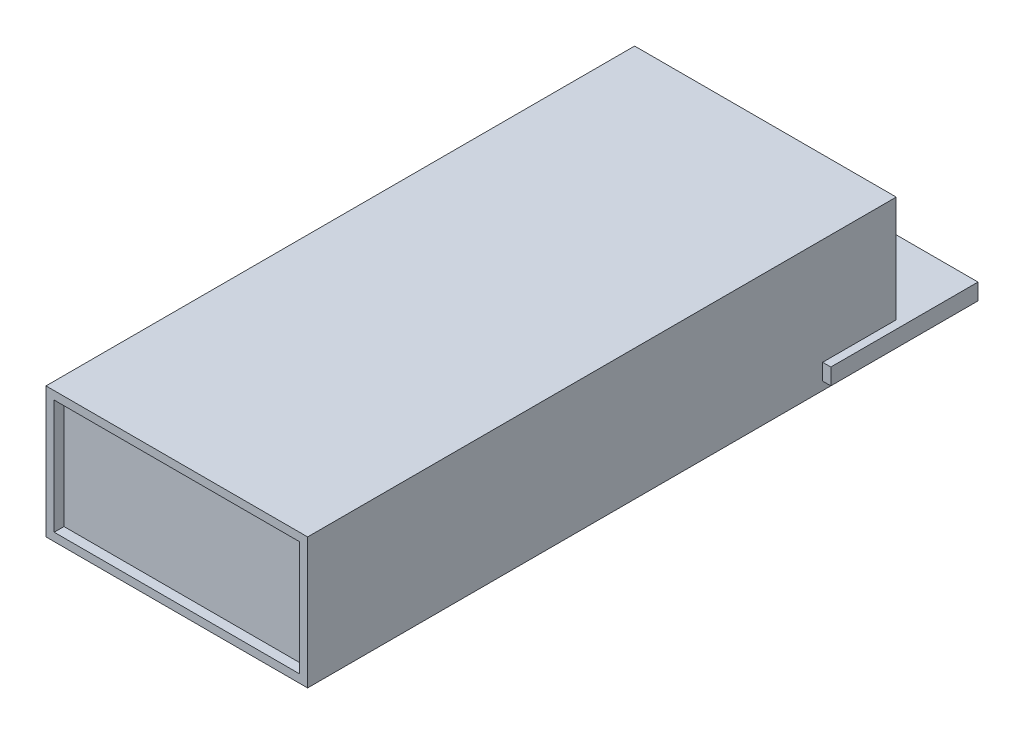
from build123d import *

# Parameters (mm, degrees)
SKETCH_1_W          = 800
SKETCH_1_H          = 400
EXTRUDE_1_DEPTH     = 1800
SKETCH_2_W          = 750
SKETCH_2_H          = 350
CUT_EXTRUDE_1_DEPTH = 30
SKETCH_3_W          = 750
SKETCH_3_H          = 20
EXTRUDE_2_DEPTH     = 800
SKETCH_4_R          = 20
EXTRUDE_3_DEPTH     = 50
SKETCH_5_W          = 850
SKETCH_5_H          = 450
EXTRUDE_4_DEPTH     = 50


with BuildPart() as part:
    # 草图1 → 凸台-拉伸1 (new body)
    with BuildSketch(Plane.XY):
        Rectangle(SKETCH_1_W, SKETCH_1_H)
    extrude(amount=EXTRUDE_1_DEPTH)

    # 草图2 → 切除-拉伸1 (cut)
    with BuildSketch(Plane.XY.offset(1800)):
        Rectangle(SKETCH_2_W, SKETCH_2_H)
    extrude(amount=-CUT_EXTRUDE_1_DEPTH, mode=Mode.SUBTRACT)

    # 草图3 → 凸台-拉伸2 (add)
    with BuildSketch(Plane.XY):
        with Locations((0, -180)):
            Rectangle(SKETCH_3_W, SKETCH_3_H)
    extrude(amount=EXTRUDE_2_DEPTH)

    # 草图4 → 凸台-拉伸3 (add)
    with BuildSketch(Plane.XY):
        with Locations((300, -180)):
            Circle(SKETCH_4_R)
    extrude(amount=EXTRUDE_3_DEPTH)

    # 草图5 → 凸台-拉伸4 (add)
    with BuildSketch(Plane(origin=(0, -175, 0), x_dir=(1, 0, 0), z_dir=(0, 1, 0))):
        Rectangle(SKETCH_5_W, SKETCH_5_H)
    extrude(amount=EXTRUDE_4_DEPTH)


solid = part.part
